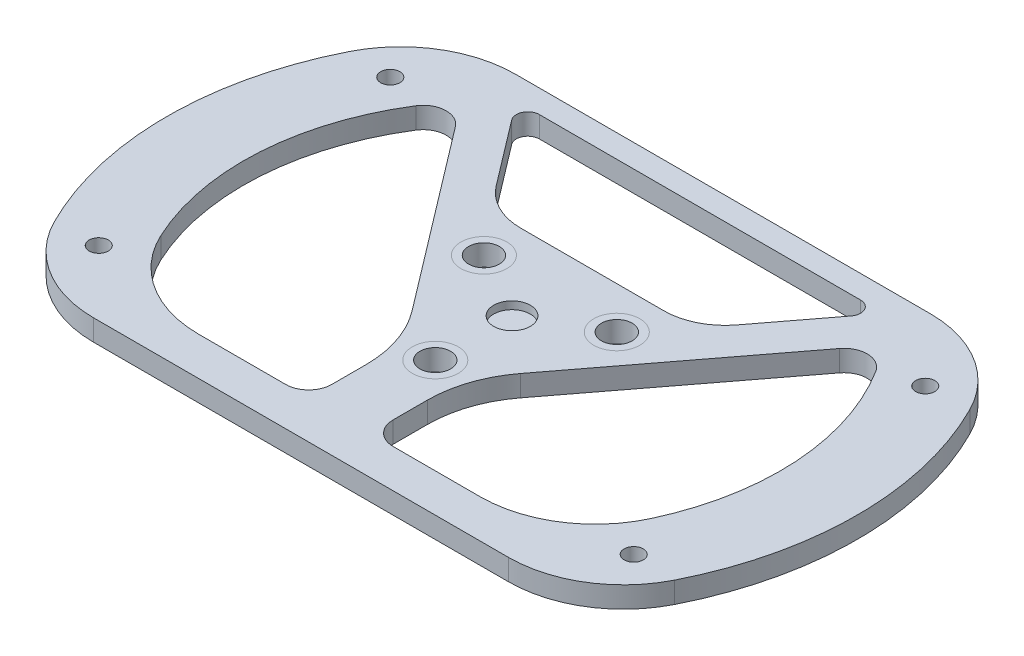
from build123d import *

# Parameters (mm, degrees)
SKETCH1_R           = 5.08
SKETCH1_R_2         = 3.175
BOSS_EXTRUDE1_DEPTH = 7
FILLET6_R           = 38.1
FILLET9_R           = 7.62
FILLET10_R          = 7.62
FILLET11_R          = 3.81
FILLET12_R          = 20.32
FILLET13_R          = 38.1
SKETCH2_R           = 6.067865864
CUT_EXTRUDE1_DEPTH  = 2.54


with BuildPart() as part:
    # Sketch1 → Boss-Extrude1 (new body)
    with BuildSketch(Plane(origin=(0, 0, 0), x_dir=(1, 0, 0), z_dir=(0, 1, 0))):
        with BuildLine():
            Line((-88.899351346, 69.85), (88.899351346, 69.85))
            ThreePointArc((88.899351346, 69.85), (114.3, 0), (88.899351346, -69.85))
            Line((88.899351346, -69.85), (-88.899351346, -69.85))
            ThreePointArc((-88.899351346, -69.85), (-114.3, 0), (-88.899351346, 69.85))
        make_face()
        with Locations(Location((0, -25.4, 0), (0, 0, 270))):
            Circle(SKETCH1_R, mode=Mode.SUBTRACT)
        with Locations(Location((-21.997045256, 12.7, 0), (0, 0, 270))):
            Circle(SKETCH1_R, mode=Mode.SUBTRACT)
        with Locations(Location((21.997045256, 12.7, 0), (0, 0, 270))):
            Circle(SKETCH1_R, mode=Mode.SUBTRACT)
        with Locations(Location((-88.560044244, 48.26, 0), (0, 0, 270))):
            Circle(SKETCH1_R_2, mode=Mode.SUBTRACT)
        with Locations(Location((-88.560044244, -48.26, 0), (0, 0, 90))):
            Circle(SKETCH1_R_2, mode=Mode.SUBTRACT)
        with Locations(Location((88.560044244, -48.26, 0), (0, 0, 270))):
            Circle(SKETCH1_R_2, mode=Mode.SUBTRACT)
        with Locations(Location((88.560044244, 48.26, 0), (0, 0, 90))):
            Circle(SKETCH1_R_2, mode=Mode.SUBTRACT)
        Polygon((-60.864265129, 62.23), (60.864265129, 62.23), (33.730665032, 26.578259891), (-33.730665032, 26.578259891), align=None, mode=Mode.SUBTRACT)
        with BuildLine():
            Line((-66.2189372, -57.15), (-10.16, -57.15))
            Line((-10.16, -57.15), (-10.16, -25.362104437))
            Line((-10.16, -25.362104437), (-69.836388427, 53.048688207))
            ThreePointArc((-69.836388427, 53.048688207), (-83.989429266, 28.185034179), (-88.9, 0))
            ThreePointArc((-88.9, 0), (-83.022483728, -30.743101298), (-66.2189372, -57.15))
        make_face(mode=Mode.SUBTRACT)
        with BuildLine():
            Line((10.16, -25.362104437), (10.16, -57.15))
            Line((10.16, -57.15), (66.2189372, -57.15))
            ThreePointArc((66.2189372, -57.15), (83.022483728, -30.743101298), (88.9, 0))
            ThreePointArc((88.9, 0), (83.989429266, 28.185034179), (69.836388427, 53.048688207))
            Line((69.836388427, 53.048688207), (10.16, -25.362104437))
        make_face(mode=Mode.SUBTRACT)
    extrude(amount=BOSS_EXTRUDE1_DEPTH)

    # Fillet6
    fillet6_edges = [part.edges().sort_by_distance(p)[0] for p in [
        (-66.2189372, 3.5, 57.15),
        (66.2189372, 3.5, 57.15),
        (-88.899351346, 3.5, -69.85),
        (88.899351346, 3.5, -69.85),
        (88.899351346, 3.5, 69.85),
        (-88.899351346, 3.5, 69.85),
    ]]
    fillet(fillet6_edges, radius=FILLET6_R)

    # Fillet9
    fillet9_edges = [part.edges().sort_by_distance(p)[0] for p in [
        (-10.16, 3.5, 57.15),
        (10.16, 3.5, 57.15),
    ]]
    fillet(fillet9_edges, radius=FILLET9_R)

    # Fillet10
    fillet10_edges = [part.edges().sort_by_distance(p)[0] for p in [
        (-69.836388427, 3.5, -53.048688207),
        (69.836388427, 3.5, -53.048688207),
    ]]
    fillet(fillet10_edges, radius=FILLET10_R)

    # Fillet11
    fillet11_edges = [part.edges().sort_by_distance(p)[0] for p in [
        (60.864265129, 3.5, -62.23),
        (-60.864265129, 3.5, -62.23),
    ]]
    fillet(fillet11_edges, radius=FILLET11_R)

    # Fillet12
    fillet12_edges = [part.edges().sort_by_distance(p)[0] for p in [
        (33.730665032, 3.5, -26.578259891),
        (-33.730665032, 3.5, -26.578259891),
    ]]
    fillet(fillet12_edges, radius=FILLET12_R)

    # Fillet13
    fillet13_edges = [part.edges().sort_by_distance(p)[0] for p in [
        (-10.16, 3.5, 25.362104437),
        (10.16, 3.5, 25.362104437),
    ]]
    fillet(fillet13_edges, radius=FILLET13_R)

    # Sketch2 → Cut-Extrude1 (cut)
    with BuildSketch(Plane(origin=(0, 7, 0), x_dir=(1, 0, 0), z_dir=(0, 1, 0))):
        with Locations(Location((0, 0, 0), (0, 0, 270))):
            Circle(SKETCH2_R)
    extrude(amount=-CUT_EXTRUDE1_DEPTH, mode=Mode.SUBTRACT)


solid = part.part
